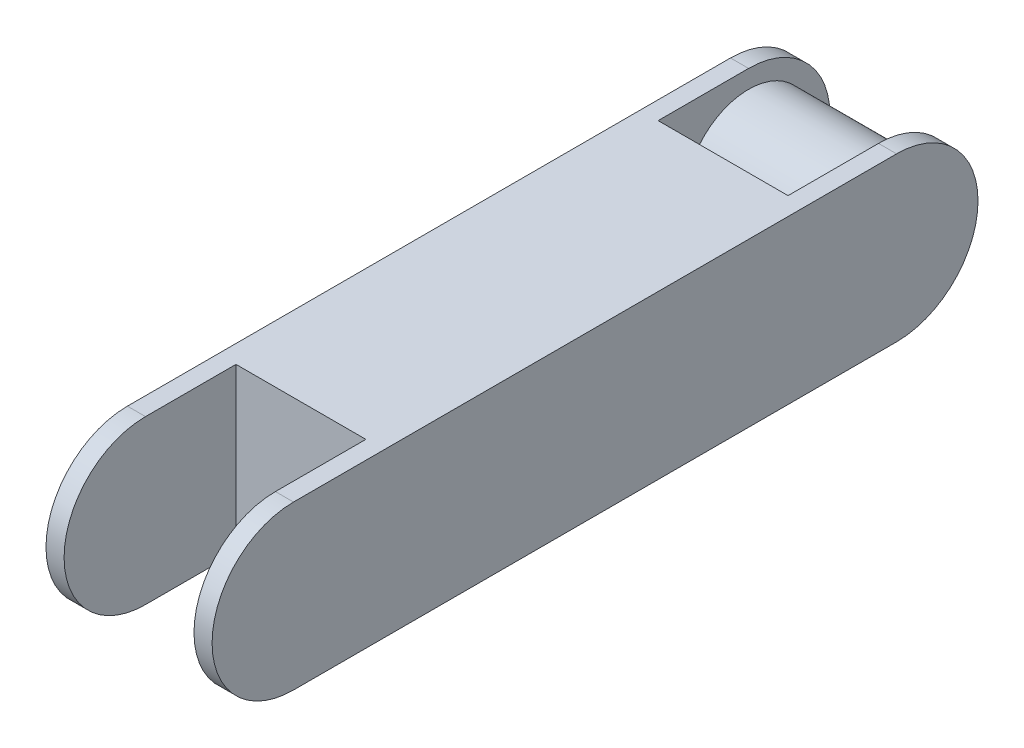
from build123d import *

# Parameters (mm, degrees)
SCHIZZO1_R                   = 10.5
ESTRUSIONE_ESTRUSIONE1_DEPTH = 10.77
ESTRUSIONE_ESTRUSIONE2_START = 10.77
ESTRUSIONE_ESTRUSIONE2_DEPTH = 3
ESTRUSIONE_ESTRUSIONE3_START = -3
SCHIZZO4_W                   = 70
SCHIZZO4_H                   = 27
ESTRUSIONE_ESTRUSIONE3_DEPTH = 21.54


with BuildPart() as part:
    # Schizzo1 → Estrusione-Estrusione1 (new, symmetric)
    with BuildSketch(Plane(origin=(0, 0, 0), x_dir=(0, 0, -1), z_dir=(1, 0, 0))):
        Circle(SCHIZZO1_R)
    extrude(amount=ESTRUSIONE_ESTRUSIONE1_DEPTH, both=True)

    # Schizzo3 → Estrusione-Estrusione2 (add)
    with BuildSketch(Plane(origin=(0, 0, 0), x_dir=(0, 0, -1), z_dir=(1, 0, 0)).offset(ESTRUSIONE_ESTRUSIONE2_START)):
        with BuildLine():
            Line((-100, 13.5), (0, 13.5))
            ThreePointArc((0, 13.5), (13.5, 0), (0, -13.5))
            Line((0, -13.5), (-100, -13.5))
            ThreePointArc((-100, -13.5), (-113.5, 0), (-100, 13.5))
        make_face()
    estrusione_estrusione2 = extrude(amount=ESTRUSIONE_ESTRUSIONE2_DEPTH)

    # Specchia4: Estrusione-Estrusione2 across plane
    add(estrusione_estrusione2.mirror(Plane(origin=(0, 0, 0), x_dir=(0, 0, 1), z_dir=(1, 0, 0))))

    # Schizzo4 → Estrusione-Estrusione3 (add)
    with BuildSketch(Plane(origin=(13.77, 0, 0), x_dir=(0, 0, -1), z_dir=(1, 0, 0)).offset(ESTRUSIONE_ESTRUSIONE3_START)):
        with Locations((-50, 0)):
            Rectangle(SCHIZZO4_W, SCHIZZO4_H)
    extrude(amount=-ESTRUSIONE_ESTRUSIONE3_DEPTH)


solid = part.part
